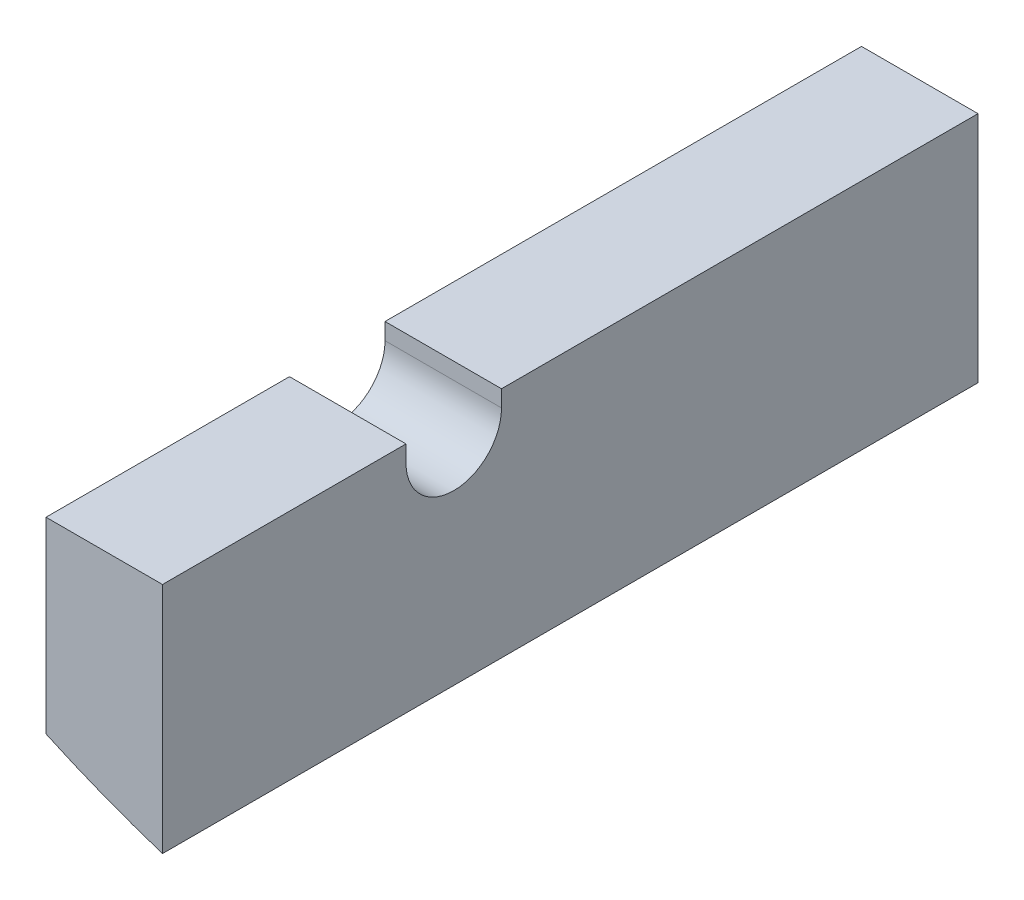
from build123d import *

# Parameters (mm, degrees)
BOSS_EXTRU_1_DEPTH      = 35
ENL_V_MAT_EXTRU_2_DEPTH = 56.894990831
ESQUISSE4_W             = 35
ESQUISSE4_H             = 0.996366886
ENL_V_MAT_EXTRU_3_DEPTH = 35


with BuildPart() as part:
    # Esquisse1 → Boss.-Extru.1 (new body)
    with BuildSketch(Plane.XY):
        with BuildLine():
            Line((-19, -41.343076809), (-19, -32.292609069))
            Line((-19, -32.292609069), (-14, -32.292609069))
            Line((-14, -32.292609069), (-14, -43.292609069))
            ThreePointArc((-14, -43.292609069), (-16.528767922, -42.391624538), (-19, -41.343076809))
        make_face()
    extrude(amount=BOSS_EXTRU_1_DEPTH)

    # Esquisse2 → Enlèv. mat.-Extru.2 (cut, through all)
    with BuildSketch(Plane.ZY.offset(19)):
        with BuildLine():
            Line((24.55, -34.002609069), (24.55, -32.292609069))
            Line((24.55, -32.292609069), (22.5, -31.952609069))
            Line((22.5, -31.952609069), (20.45, -32.292609069))
            Line((20.45, -32.292609069), (20.45, -34.002609069))
            ThreePointArc((20.45, -34.002609069), (22.5, -36.052609069), (24.55, -34.002609069))
        make_face()
    extrude(amount=-ENL_V_MAT_EXTRU_2_DEPTH, mode=Mode.SUBTRACT)

    # Esquisse4 → Enlèv. mat.-Extru.3 (cut)
    with BuildSketch(Plane.ZY.offset(19)):
        with Locations((17.5, -32.790792512)):
            Rectangle(ESQUISSE4_W, ESQUISSE4_H)
    extrude(amount=-ENL_V_MAT_EXTRU_3_DEPTH, mode=Mode.SUBTRACT)


solid = part.part
